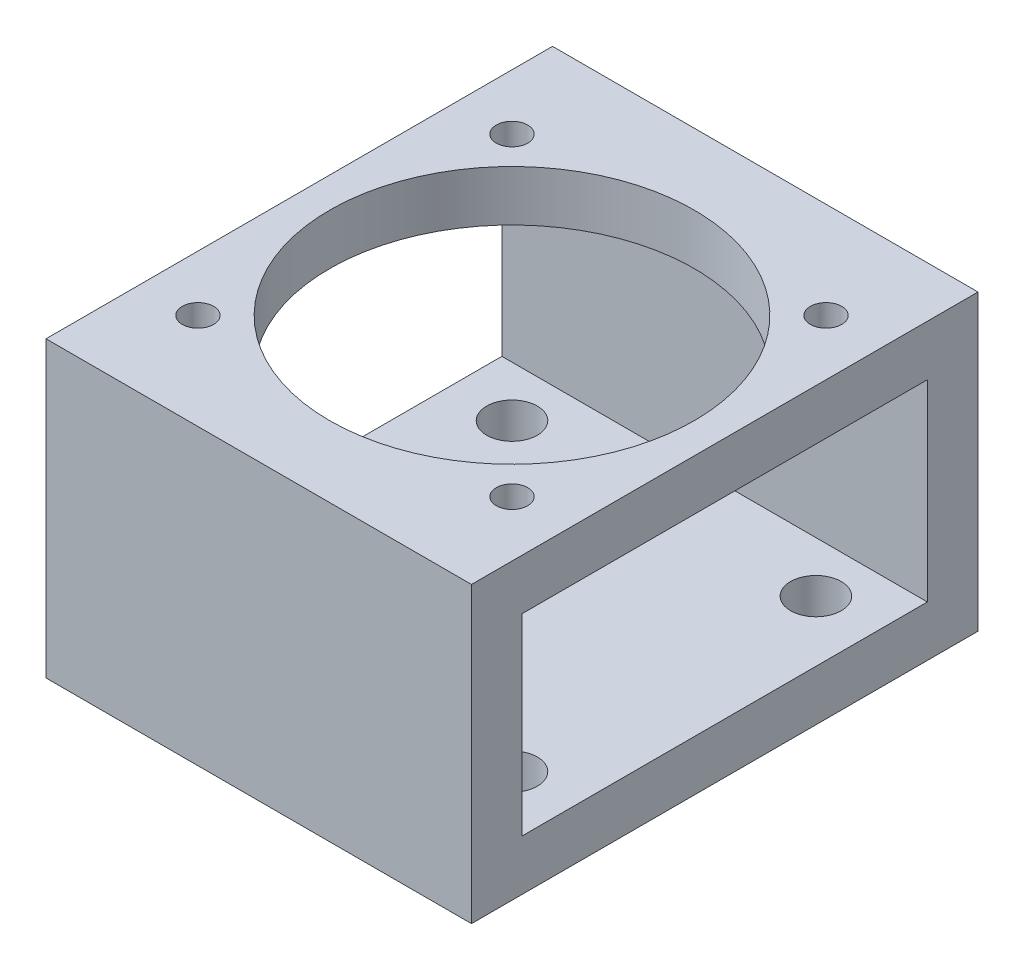
from build123d import *

# Parameters (mm, degrees)
SKETCH1_W           = 42
SKETCH1_H           = 50
BOSS_EXTRUDE1_DEPTH = 8
CUT_EXTRUDE1_REACH  = 35.615
SKETCH2_R           = 1.55
SKETCH2_R_2         = 18
SKETCH3_W           = 42
SKETCH3_H           = 50
BOSS_EXTRUDE2_DEPTH = 21
CUT_EXTRUDE2_REACH  = 55.198
SKETCH4_W           = 40
SKETCH4_H           = 19
CUT_EXTRUDE3_REACH  = 45.669
SKETCH6_R           = 2.5


with BuildPart() as part:
    # Sketch1 → Boss-Extrude1 (new body)
    with BuildSketch(Plane(origin=(0, 0, 0), x_dir=(1, 0, 0), z_dir=(0, 1, 0))):
        Rectangle(SKETCH1_W, SKETCH1_H)
    extrude(amount=BOSS_EXTRUDE1_DEPTH)

    # Sketch2 → Cut-Extrude1 (cut, up to next)
    with BuildSketch(Plane(origin=(0, 8, 0), x_dir=(1, 0, 0), z_dir=(0, 1, 0)), mode=Mode.PRIVATE) as cut_extrude1_sk1:
        with Locations(Location((-15.5, 15.5, 0), (0, 0, 270))):
            Circle(SKETCH2_R)
    cut_extrude1_tool1 = extrude(cut_extrude1_sk1.sketch, amount=-CUT_EXTRUDE1_REACH, mode=Mode.PRIVATE) & part.part
    # Sketch2 → Cut-Extrude1 (cut, up to next)
    with BuildSketch(Plane(origin=(0, 8, 0), x_dir=(1, 0, 0), z_dir=(0, 1, 0)), mode=Mode.PRIVATE) as cut_extrude1_sk2:
        with Locations(Location((15.5, 15.5, 0), (0, 0, 270))):
            Circle(SKETCH2_R)
    cut_extrude1_tool2 = extrude(cut_extrude1_sk2.sketch, amount=-CUT_EXTRUDE1_REACH, mode=Mode.PRIVATE) & part.part
    # Sketch2 → Cut-Extrude1 (cut, up to next)
    with BuildSketch(Plane(origin=(0, 8, 0), x_dir=(1, 0, 0), z_dir=(0, 1, 0)), mode=Mode.PRIVATE) as cut_extrude1_sk3:
        with Locations(Location((15.5, -15.5, 0), (0, 0, 270))):
            Circle(SKETCH2_R)
    cut_extrude1_tool3 = extrude(cut_extrude1_sk3.sketch, amount=-CUT_EXTRUDE1_REACH, mode=Mode.PRIVATE) & part.part
    # Sketch2 → Cut-Extrude1 (cut, up to next)
    with BuildSketch(Plane(origin=(0, 8, 0), x_dir=(1, 0, 0), z_dir=(0, 1, 0)), mode=Mode.PRIVATE) as cut_extrude1_sk4:
        with Locations(Location((-15.5, -15.5, 0), (0, 0, 270))):
            Circle(SKETCH2_R)
    cut_extrude1_tool4 = extrude(cut_extrude1_sk4.sketch, amount=-CUT_EXTRUDE1_REACH, mode=Mode.PRIVATE) & part.part
    # Sketch2 → Cut-Extrude1 (cut, up to next)
    with BuildSketch(Plane(origin=(0, 8, 0), x_dir=(1, 0, 0), z_dir=(0, 1, 0)), mode=Mode.PRIVATE) as cut_extrude1_sk5:
        with Locations(Location((0, 0, 0), (0, 0, 270))):
            Circle(SKETCH2_R_2)
    cut_extrude1_tool5 = extrude(cut_extrude1_sk5.sketch, amount=-CUT_EXTRUDE1_REACH, mode=Mode.PRIVATE) & part.part
    add(cut_extrude1_tool1.solids().sort_by_distance((-15.5, 8, -15.5))[0], mode=Mode.SUBTRACT)
    add(cut_extrude1_tool2.solids().sort_by_distance((15.5, 8, -15.5))[0], mode=Mode.SUBTRACT)
    add(cut_extrude1_tool3.solids().sort_by_distance((15.5, 8, 15.5))[0], mode=Mode.SUBTRACT)
    add(cut_extrude1_tool4.solids().sort_by_distance((-15.5, 8, 15.5))[0], mode=Mode.SUBTRACT)
    add(cut_extrude1_tool5.solids().sort_by_distance((0, 8, 0))[0], mode=Mode.SUBTRACT)

    # Sketch3 → Boss-Extrude2 (add)
    with BuildSketch(Plane(origin=(0, 0, 0), x_dir=(1, 0, 0), z_dir=(0, 1, 0))):
        Rectangle(SKETCH3_W, SKETCH3_H)
    extrude(amount=-BOSS_EXTRUDE2_DEPTH)

    # Sketch4 → Cut-Extrude2 (cut, up to next)
    with BuildSketch(Plane.ZY.offset(21), mode=Mode.PRIVATE) as cut_extrude2_sk1:
        with Locations((0, -6.5)):
            Rectangle(SKETCH4_W, SKETCH4_H)
    cut_extrude2_tool1 = extrude(cut_extrude2_sk1.sketch, amount=-CUT_EXTRUDE2_REACH, mode=Mode.PRIVATE) & part.part
    add(cut_extrude2_tool1.solids().sort_by_distance((-21, -6.5, 0))[0], mode=Mode.SUBTRACT)

    # Sketch6 → Cut-Extrude3 (cut, up to next)
    with BuildSketch(Plane(origin=(0, -21, 0), x_dir=(-1, 0, 0), z_dir=(0, -1, 0)), mode=Mode.PRIVATE) as cut_extrude3_sk1:
        with Locations(Location((-15, 15, 0), (0, 0, 90))):
            Circle(SKETCH6_R)
    cut_extrude3_tool1 = extrude(cut_extrude3_sk1.sketch, amount=-CUT_EXTRUDE3_REACH, mode=Mode.PRIVATE) & part.part
    # Sketch6 → Cut-Extrude3 (cut, up to next)
    with BuildSketch(Plane(origin=(0, -21, 0), x_dir=(-1, 0, 0), z_dir=(0, -1, 0)), mode=Mode.PRIVATE) as cut_extrude3_sk2:
        with Locations(Location((15, 15, 0), (0, 0, 90))):
            Circle(SKETCH6_R)
    cut_extrude3_tool2 = extrude(cut_extrude3_sk2.sketch, amount=-CUT_EXTRUDE3_REACH, mode=Mode.PRIVATE) & part.part
    # Sketch6 → Cut-Extrude3 (cut, up to next)
    with BuildSketch(Plane(origin=(0, -21, 0), x_dir=(-1, 0, 0), z_dir=(0, -1, 0)), mode=Mode.PRIVATE) as cut_extrude3_sk3:
        with Locations(Location((15, -15, 0), (0, 0, 90))):
            Circle(SKETCH6_R)
    cut_extrude3_tool3 = extrude(cut_extrude3_sk3.sketch, amount=-CUT_EXTRUDE3_REACH, mode=Mode.PRIVATE) & part.part
    # Sketch6 → Cut-Extrude3 (cut, up to next)
    with BuildSketch(Plane(origin=(0, -21, 0), x_dir=(-1, 0, 0), z_dir=(0, -1, 0)), mode=Mode.PRIVATE) as cut_extrude3_sk4:
        with Locations(Location((-15, -15, 0), (0, 0, 90))):
            Circle(SKETCH6_R)
    cut_extrude3_tool4 = extrude(cut_extrude3_sk4.sketch, amount=-CUT_EXTRUDE3_REACH, mode=Mode.PRIVATE) & part.part
    add(cut_extrude3_tool1.solids().sort_by_distance((15, -21, -15))[0], mode=Mode.SUBTRACT)
    add(cut_extrude3_tool2.solids().sort_by_distance((-15, -21, -15))[0], mode=Mode.SUBTRACT)
    add(cut_extrude3_tool3.solids().sort_by_distance((-15, -21, 15))[0], mode=Mode.SUBTRACT)
    add(cut_extrude3_tool4.solids().sort_by_distance((15, -21, 15))[0], mode=Mode.SUBTRACT)


solid = part.part
